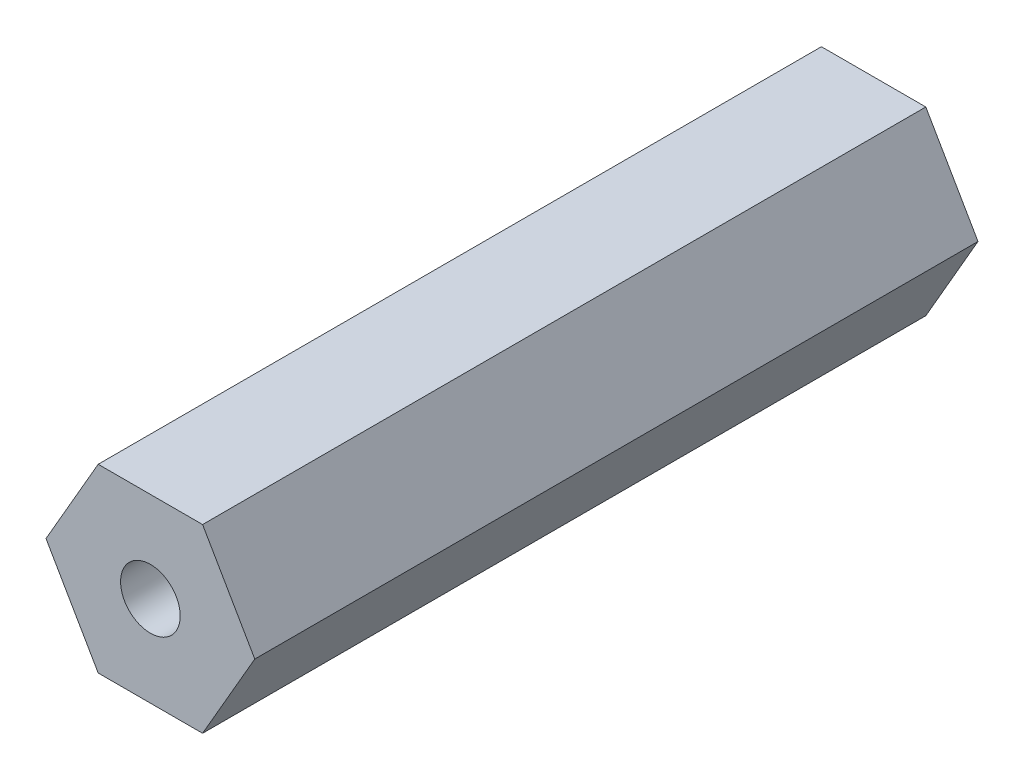
from build123d import *

# Parameters (mm, degrees)
BOSS_EXTRU_1_DEPTH      = 40
ESQUISSE2_R             = 1.65
ENL_V_MAT_EXTRU_1_DEPTH = 9
ENL_V_START             = -31
ESQUISSE2_2_R           = 1.65
ENL_V_MAT_EXTRU_2_DEPTH = 9


with BuildPart() as part:
    # Esquisse1 → Boss.-Extru.1 (new body)
    with BuildSketch(Plane.XY):
        Polygon((5.773502692, 0), (2.886751346, 5), (-2.886751346, 5), (-5.773502692, 0), (-2.886751346, -5), (2.886751346, -5), align=None)
    extrude(amount=BOSS_EXTRU_1_DEPTH)

    # Esquisse2 → Enlèv. mat.-Extru.1 (cut)
    with BuildSketch(Plane.XY.offset(40)):
        Circle(ESQUISSE2_R)
    extrude(amount=-ENL_V_MAT_EXTRU_1_DEPTH, mode=Mode.SUBTRACT)

    # Esquisse2<2> → Enlèv. mat.-Extru.2 (cut)
    with BuildSketch(Plane.XY.offset(40).offset(ENL_V_START)):
        Circle(ESQUISSE2_2_R)
    extrude(amount=-ENL_V_MAT_EXTRU_2_DEPTH, mode=Mode.SUBTRACT)


solid = part.part
